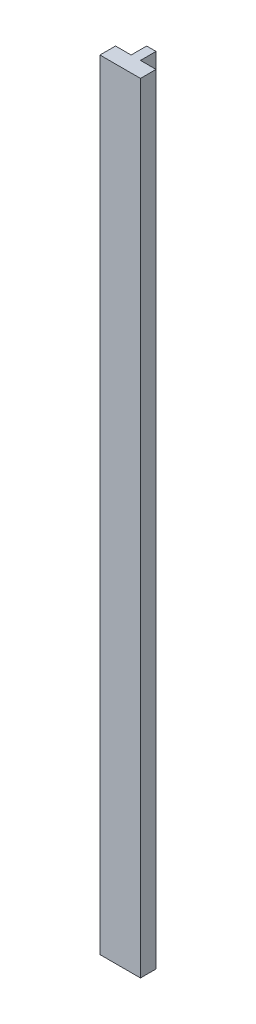
from build123d import *

# Parameters (mm, degrees)
EXTRUDE_1_DEPTH = 500


with BuildPart() as part:
    # 草图2 → 凸台-拉伸1 (new body)
    with BuildSketch(Plane(origin=(0, 0, 0), x_dir=(1, 0, 0), z_dir=(0, 1, 0))):
        Polygon((0, 0), (10, 0), (10, 10), (16, 10), (16, 0), (26, 0), (26, -10), (0, -10), align=None)
    extrude(amount=EXTRUDE_1_DEPTH)


solid = part.part
